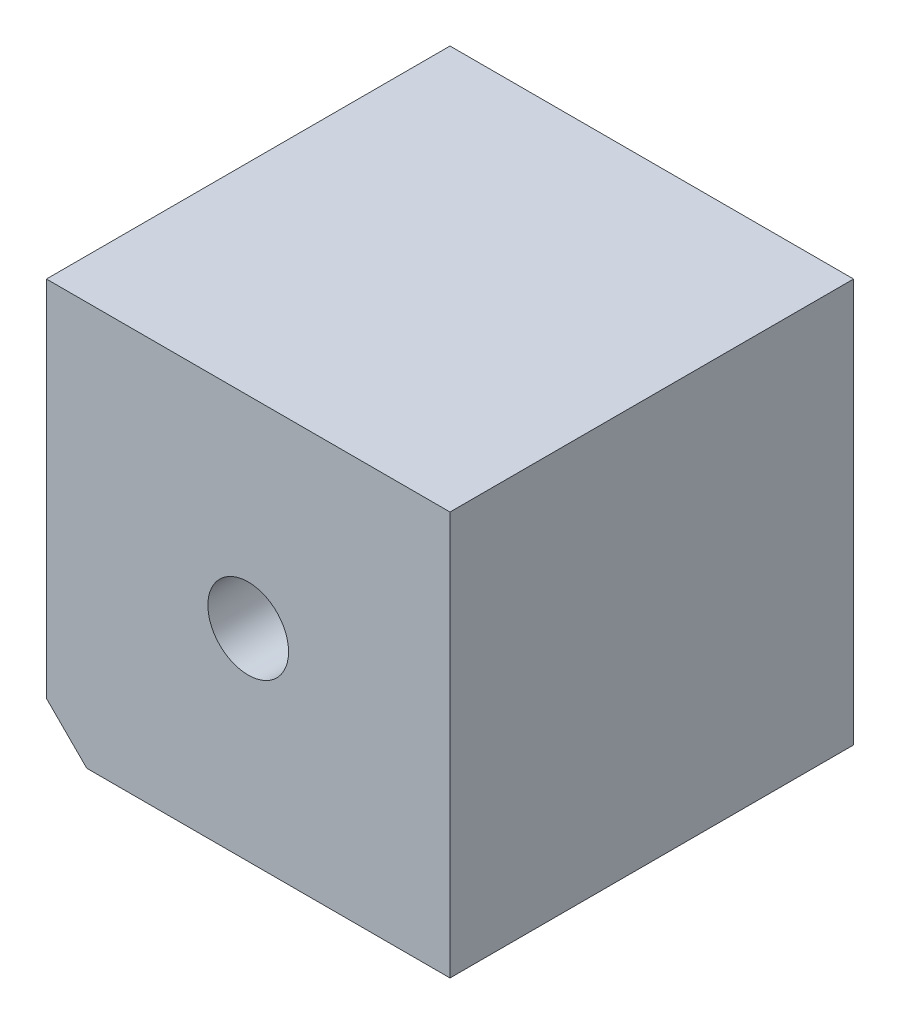
from build123d import *

# Parameters (mm, degrees)
SKETCH1_W           = 100
SKETCH1_H           = 100
BOSS_EXTRUDE1_DEPTH = 100
SKETCH2_R           = 10
CUT_EXTRUDE1_DEPTH  = 58
CHAMFER1_SIZE       = 10


with BuildPart() as part:
    # Sketch1 → Boss-Extrude1 (new body)
    with BuildSketch(Plane.XY):
        Rectangle(SKETCH1_W, SKETCH1_H)
    extrude(amount=BOSS_EXTRUDE1_DEPTH)

    # Sketch2 → Cut-Extrude1 (cut)
    with BuildSketch(Plane.XY.offset(100)):
        Circle(SKETCH2_R)
    extrude(amount=-CUT_EXTRUDE1_DEPTH, mode=Mode.SUBTRACT)

    # Chamfer1
    chamfer1_edges = [part.edges().sort_by_distance(p)[0] for p in [
        (-50, -50, 50),
    ]]
    chamfer(chamfer1_edges, length=CHAMFER1_SIZE)


solid = part.part
